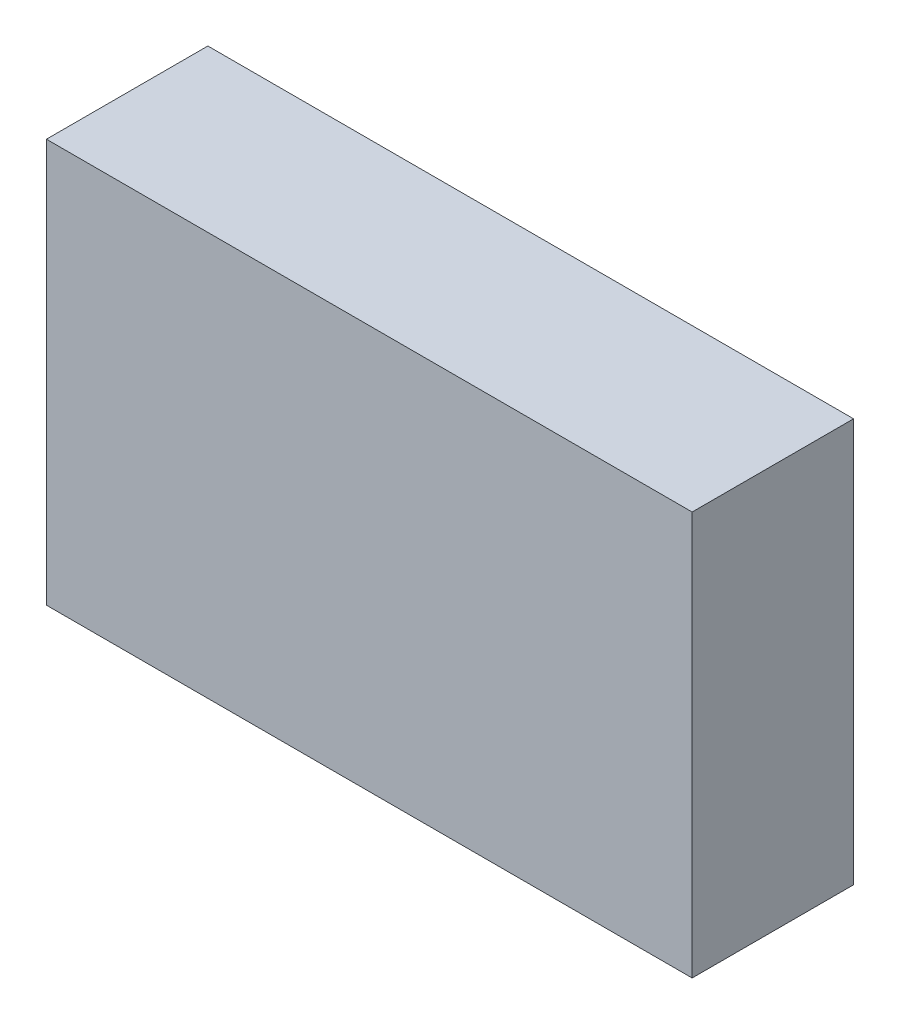
from build123d import *

# Parameters (mm, degrees)
SKETCH_1_W      = 80
SKETCH_1_H      = 50
EXTRUDE_1_DEPTH = 20
SKETCH_2_R      = 2.5
EXTRUDE_2_DEPTH = 1.5


with BuildPart() as part:
    # 草图1 → 凸台-拉伸1 (new body)
    with BuildSketch(Plane.XY):
        Rectangle(SKETCH_1_W, SKETCH_1_H)
    extrude(amount=EXTRUDE_1_DEPTH)

    # 草图2 → 凸台-拉伸2 (add, symmetric)
    with BuildSketch(Plane(origin=(0, 0, 0), x_dir=(1, 0, 0), z_dir=(0, 1, 0))):
        with BuildLine():
            Line((-15, 0), (15, 0))
            ThreePointArc((15, 0), (0, 15), (-15, 0))
        make_face()
        with Locations(Location((0, 8, 0), (0, 0, 270))):
            Circle(SKETCH_2_R, mode=Mode.SUBTRACT)
    extrude(amount=EXTRUDE_2_DEPTH, both=True)


solid = part.part
